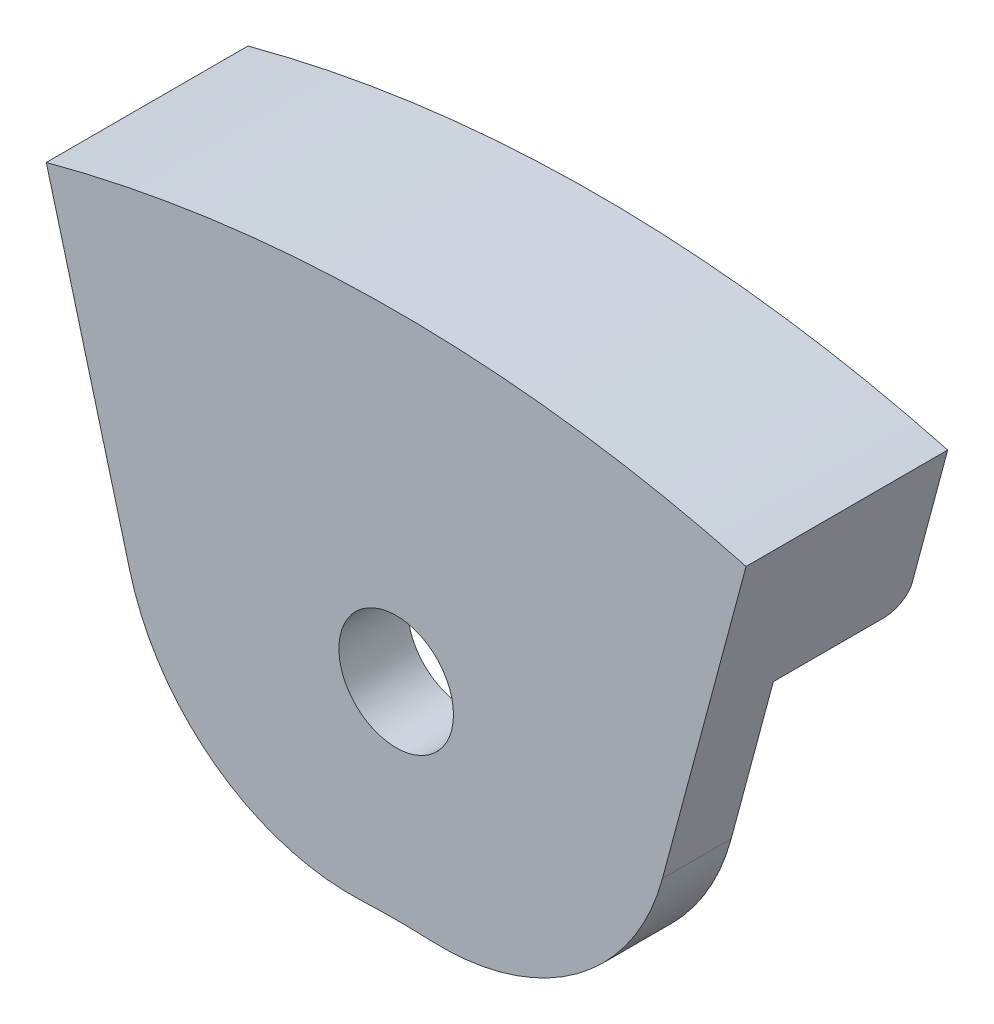
from build123d import *

# Parameters (mm, degrees)
EXTRUDE_1_DEPTH = 2.9
SKETCH_2_R      = 1.25
EXTRUDE_2_DEPTH = 1.5
FILLET_1_R      = 5
FILLET_2_R      = 0.5


with BuildPart() as part:
    # 草图1 → 凸台-拉伸1 (new body)
    with BuildSketch(Plane.XY):
        with BuildLine():
            Line((-7.635161831, 28.494811876), (-6.729295173, 25.114071484))
            ThreePointArc((-6.729295173, 25.114071484), (0, 26), (6.729295173, 25.114071484))
            Line((6.729295173, 25.114071484), (7.635161831, 28.494811876))
            ThreePointArc((7.635161831, 28.494811876), (0, 29.5), (-7.635161831, 28.494811876))
        make_face()
    extrude(amount=EXTRUDE_1_DEPTH)

    # 草图2 → 凸台-拉伸2 (add)
    with BuildSketch(Plane.XY.offset(2.9)):
        with BuildLine():
            Line((-7.635161831, 28.494811876), (-4.658742812, 17.386664873))
            ThreePointArc((-4.658742812, 17.386664873), (0, 18), (4.658742812, 17.386664873))
            Line((4.658742812, 17.386664873), (7.635161831, 28.494811876))
            ThreePointArc((7.635161831, 28.494811876), (0, 29.5), (-7.635161831, 28.494811876))
        make_face()
        with Locations((0, 22.5)):
            Circle(SKETCH_2_R, mode=Mode.SUBTRACT)
    extrude(amount=EXTRUDE_2_DEPTH)

    # 圆角1
    fillet_1_edges = [part.edges().sort_by_distance(p)[0] for p in [
        (-4.658742812, 17.386664873, 3.65),
        (4.658742812, 17.386664873, 3.65),
    ]]
    fillet(fillet_1_edges, radius=FILLET_1_R)

    # 圆角2
    fillet_2_edges = [part.edges().sort_by_distance(p)[0] for p in [
        (0, 26, 0),
    ]]
    fillet(fillet_2_edges, radius=FILLET_2_R)


solid = part.part
